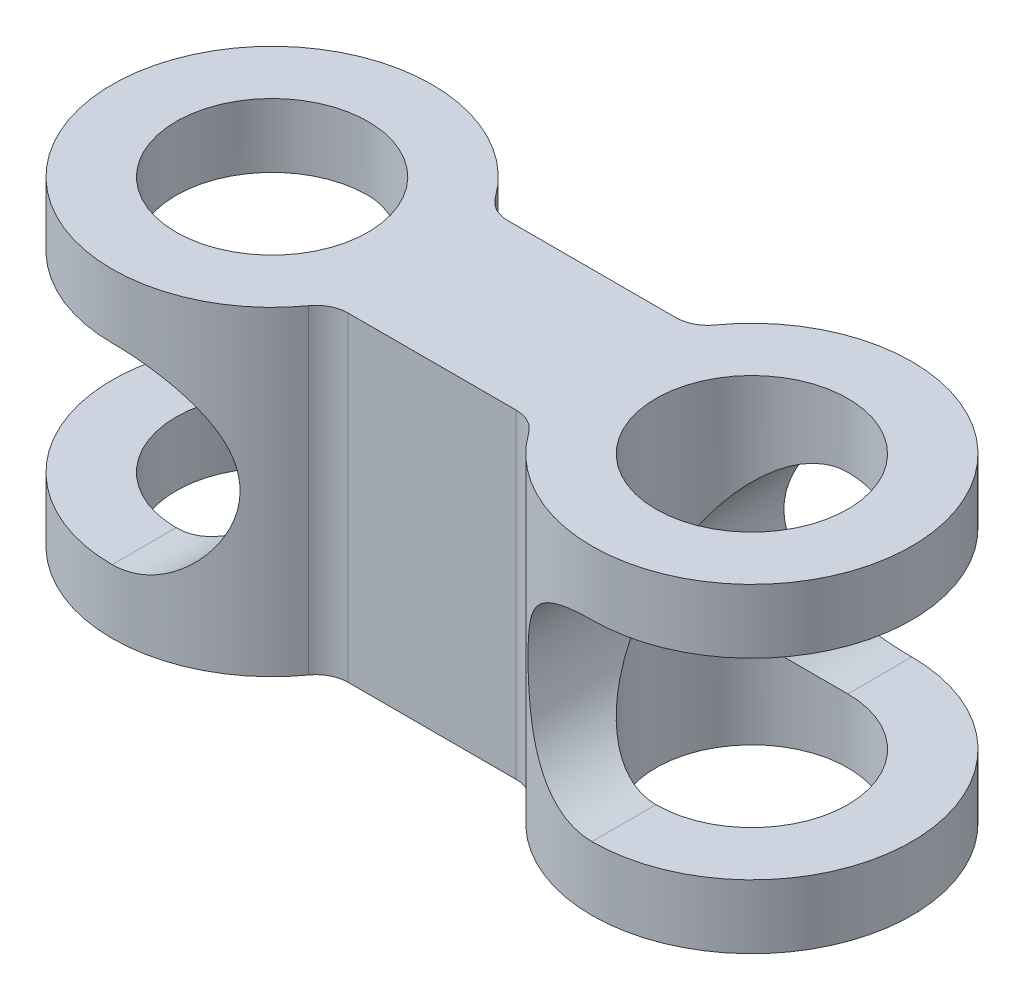
from build123d import *

# Parameters (mm, degrees)
SKETCH1_W            = 7.5
SKETCH1_H            = 5
BOSS_EXTRUDE1_DEPTH  = 10
SKETCH2_R            = 5
BOSS_EXTRUDE2_DEPTH  = 10
CUT_EXTRUDE1_REACH   = 15.463
SKETCH3_R            = 3
CUT_EXTRUDE2_DEPTH   = 14.462912018
FILLET1_R            = 1
FILLET1_OF_MIRROR1_R = 1


with BuildPart() as part:
    # Sketch1 → Boss-Extrude1 (new body)
    with BuildSketch(Plane(origin=(0, 0, 0), x_dir=(1, 0, 0), z_dir=(0, 1, 0))):
        with Locations((3.75, 0)):
            Rectangle(SKETCH1_W, SKETCH1_H)
    boss_extrude1 = extrude(amount=BOSS_EXTRUDE1_DEPTH)

    # Sketch2 → Boss-Extrude2 (add)
    with BuildSketch(Plane(origin=(0, 0, 0), x_dir=(1, 0, 0), z_dir=(0, 1, 0))):
        Circle(SKETCH2_R)
    boss_extrude2 = extrude(amount=BOSS_EXTRUDE2_DEPTH)

    # Sketch3 → Cut-Extrude1 (cut, up to next)
    with BuildSketch(Plane(origin=(0, 0, 0), x_dir=(1, 0, 0), z_dir=(0, 1, 0)), mode=Mode.PRIVATE) as cut_extrude1_sk1:
        with Locations(Location((0, 0, 0), (0, 0, 270))):
            Circle(SKETCH3_R)
    cut_extrude1_tool1 = extrude(cut_extrude1_sk1.sketch, amount=CUT_EXTRUDE1_REACH, mode=Mode.PRIVATE) & part.part
    cut_extrude1 = cut_extrude1_tool1.solids().sort_by_distance((0, 0, 0))[0]
    add(cut_extrude1, mode=Mode.SUBTRACT)

    # Sketch4 → Cut-Extrude2 (cut, symmetric)
    with BuildSketch(Plane.XY):
        with BuildLine():
            Line((0, 8), (-5, 8))
            Line((-5, 8), (-5, 2))
            Line((-5, 2), (0, 2))
            ThreePointArc((0, 2), (3, 5), (0, 8))
        make_face()
    cut_extrude2 = extrude(amount=CUT_EXTRUDE2_DEPTH, both=True, mode=Mode.SUBTRACT)

    # Fillet1
    fillet1_edges = [part.edges().sort_by_distance(p)[0] for p in [
        (4.330127019, 5, 2.5),
        (4.330127019, 5, -2.5),
    ]]
    fillet(fillet1_edges, radius=FILLET1_R)

    # Mirror1: Boss-Extrude1, Boss-Extrude2, Cut-Extrude1, Cut-Extrude2 across plane
    add(boss_extrude1.mirror(Plane(origin=(7.5, 10, -2.5), x_dir=(0, 0, 1), z_dir=(-1, 0, 0))))
    add(boss_extrude2.mirror(Plane(origin=(7.5, 10, -2.5), x_dir=(0, 0, 1), z_dir=(-1, 0, 0))))
    add(cut_extrude1.mirror(Plane(origin=(7.5, 10, -2.5), x_dir=(0, 0, 1), z_dir=(-1, 0, 0))), mode=Mode.SUBTRACT)
    add(cut_extrude2.mirror(Plane(origin=(7.5, 10, -2.5), x_dir=(0, 0, 1), z_dir=(-1, 0, 0))), mode=Mode.SUBTRACT)

    # Fillet1 of Mirror1
    fillet1_of_mirror1_edges = [part.edges().sort_by_distance(p)[0] for p in [
        (10.669872981, 5, 2.5),
        (10.669872981, 5, -2.5),
    ]]
    fillet(fillet1_of_mirror1_edges, radius=FILLET1_OF_MIRROR1_R)


solid = part.part
